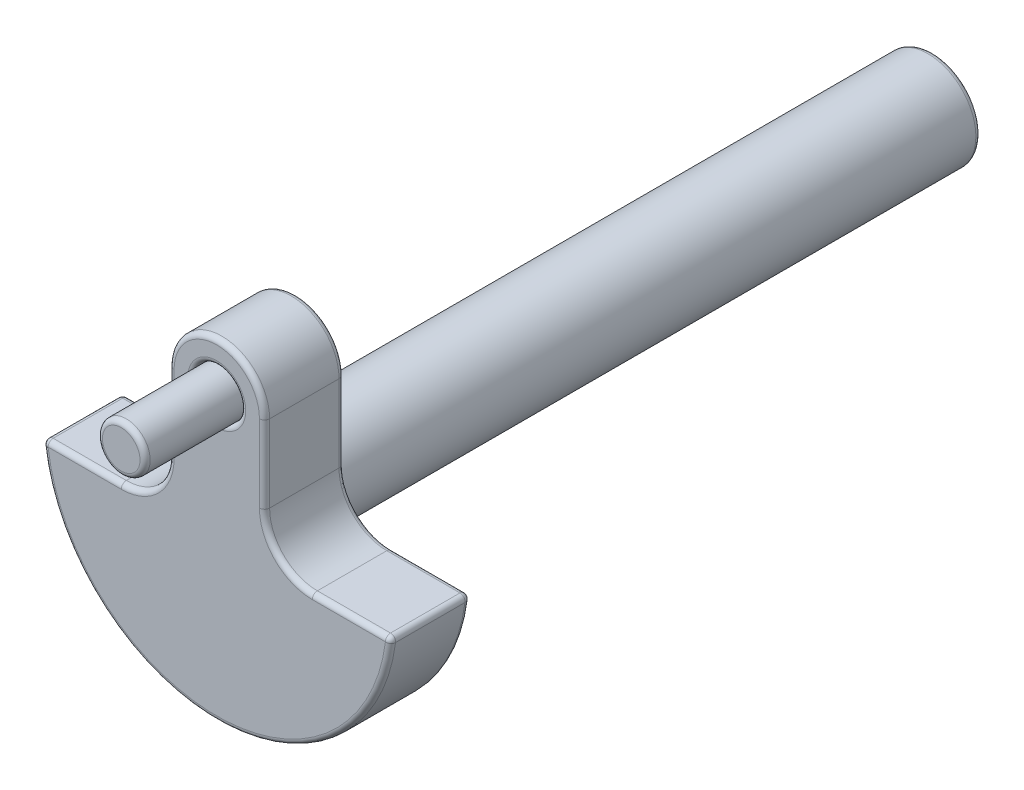
from build123d import *

# Parameters (mm, degrees)
BOSS_EXTRUDE1_DEPTH      = 3.96875
SKETCH2_R                = 1.984375
SKETCH2_R_2              = 1.190625
CUT_EXTRUDE1_DEPTH       = 13.944255329
BOSS_EXTRUDE2_DEPTH      = 4.7625
BOSS_EXTRUDE2_DEPTH_BACK = 3.96875
SKETCH3_R                = 1.190625
FILLET1_R                = 0.254
FILLET3_R                = 0.254
FILLET4_R                = 0.254
FILLET5_R                = 0.254


with BuildPart() as part:
    # Sketch1 → Boss-Extrude1 (new body)
    with BuildSketch(Plane.XY):
        with BuildLine():
            Line((-2.38125, 5.418637314), (-2.38125, 1.564743007))
            ThreePointArc((-2.38125, 1.564743007), (-3.078701977, -0.119055015), (-4.7625, -0.816506993))
            Line((-4.7625, -0.816506993), (-8.692988145, -0.816506993))
            ThreePointArc((-8.692988145, -0.816506993), (0, -8.73125), (8.692988145, -0.816506993))
            Line((8.692988145, -0.816506993), (4.7625, -0.816506993))
            ThreePointArc((4.7625, -0.816506993), (3.078701977, -0.119055015), (2.38125, 1.564743007))
            Line((2.38125, 1.564743007), (2.38125, 5.418637314))
            ThreePointArc((2.38125, 5.418637314), (0, 7.799887314), (-2.38125, 5.418637314))
        make_face()
    extrude(amount=-BOSS_EXTRUDE1_DEPTH)

    # Sketch2 → Cut-Extrude1 (cut, through all)
    with BuildSketch(Plane.XY):
        Circle(SKETCH2_R)
        with Locations((0, 5.418637314)):
            Circle(SKETCH2_R_2)
    extrude(amount=-CUT_EXTRUDE1_DEPTH, mode=Mode.SUBTRACT)

    # Sketch4 → Revolve1 (revolve)
    with BuildSketch(Plane(origin=(0, 0, 0), x_dir=(0, 0, -1), z_dir=(1, 0, 0)), mode=Mode.PRIVATE) as revolve1_sk:
        Polygon((35.71875, 0), (35.71875, 2.38125), (3.96875, 2.38125), (3.96875, 1.984375), (0, 1.984375), (0, 0), align=None)
    revolve(revolve1_sk.sketch.rotate(Axis((0, 0, 0), (0, 0, -1)), 90), axis=Axis((0, 0, 0), (0, 0, -1)))

    # Fillet1
    fillet1_edges = [part.edges().sort_by_distance(p)[0] for p in [
        (8.692988145, -0.816506993, -1.984375),
        (-8.692988145, -0.816506993, -1.984375),
        (-1.190625, 5.418637314, -3.96875),
        (-1.190625, 5.418637314, 0),
    ]]
    fillet(fillet1_edges, radius=FILLET1_R)

    # Fillet3
    fillet3_edges = [part.edges().sort_by_distance(p)[0] for p in [
        (-2.38125, 3.491690161, 0),
        (0, 7.799887314, 0),
        (2.38125, 3.491690161, 0),
        (3.078701977, -0.119055015, 0),
        (0, 7.799887314, -3.96875),
        (-2.38125, 3.491690161, -3.96875),
        (-3.078701977, -0.119055015, -3.96875),
        (-6.585943281, -0.816506993, -3.96875),
        (3.078701977, -0.119055015, -3.96875),
        (0, -8.73125, 0),
        (6.585943281, -0.816506993, 0),
        (8.599994903, -0.902624712, 0),
        (-8.599994903, -0.902624712, 0),
        (6.585943281, -0.816506993, -3.96875),
        (0, -8.73125, -3.96875),
        (8.599994903, -0.902624712, -3.96875),
        (-8.599994903, -0.902624712, -3.96875),
        (2.38125, 3.491690161, -3.96875),
        (-6.585943281, -0.816506993, 0),
        (-3.078701977, -0.119055015, 0),
    ]]
    fillet(fillet3_edges, radius=FILLET3_R)

    # Fillet5
    fillet5_edges = [part.edges().sort_by_distance(p)[0] for p in [
        (-2.38125, 0, -35.71875),
    ]]
    fillet(fillet5_edges, radius=FILLET5_R)


with BuildPart() as body_2:
    # Sketch3 → Boss-Extrude2 (new, two sides: drawn at the far end of the back side and taken through both)
    with BuildSketch(Plane.XY.offset(-BOSS_EXTRUDE2_DEPTH_BACK)):
        with Locations((0, 5.418637314)):
            Circle(SKETCH3_R)
    extrude(amount=BOSS_EXTRUDE2_DEPTH + BOSS_EXTRUDE2_DEPTH_BACK)

    # Fillet4
    fillet4_edges = [body_2.edges().sort_by_distance(p)[0] for p in [
        (-1.190625, 5.418637314, 4.7625),
        (-1.190625, 5.418637314, -3.96875),
    ]]
    fillet(fillet4_edges, radius=FILLET4_R)


solid = Compound([part.part, body_2.part])
